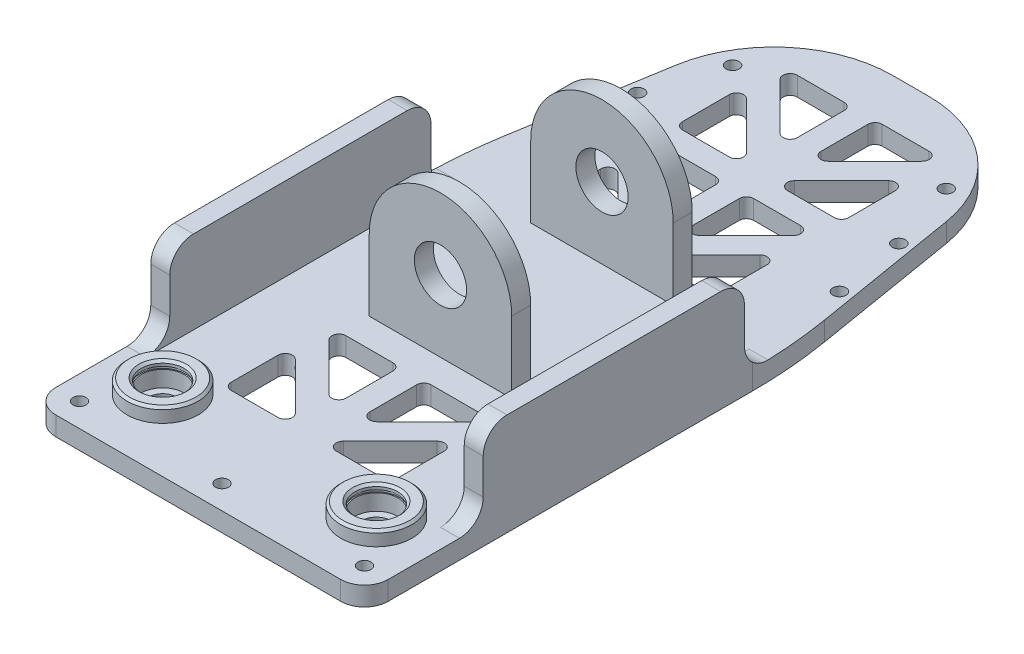
from build123d import *

# Parameters (mm, degrees)
EXTRUDE_1_DEPTH            = 8
EXTRUDE_START              = -100
EXTRUDE_3_DEPTH            = 80
SKETCH_5_W                 = 80
SKETCH_5_H                 = 60
CUT_EXTRUDE_2_DEPTH        = 110
FILLET_1_R                 = 50
FILLET_2_R                 = 200
SKETCH_7_R                 = 9
CUT_EXTRUDE_6_DEPTH        = 4
SKETCH_10_R                = 6
CUT_EXTRUDE_7_DEPTH        = 28
SKETCH_12_R                = 15
EXTRUDE_5_DEPTH            = 6
SKETCH_13_R                = 9
CUT_EXTRUDE_9_DEPTH        = 6
CUT_EXTRUDE_START          = -2.15
SKETCH_14_R                = 9.5
CUT_EXTRUDE_4235_DEPTH     = 1.1
CHAMFER_1_SIZE             = 1
CHAMFER_1_OF_MIRROR_1_SIZE = 1
SKETCH_23_W                = 8
SKETCH_23_H                = 110
EXTRUDE_7_DEPTH            = 35
FILLET_5_R                 = 10
MOVE_FACE_1_BY             = 2
MOVE_FACE_1_2_BY           = 2
SKETCH_24_R                = 2.75
CUT_EXTRUDE_13_DEPTH       = 40
FILLET_6_R                 = 3


with BuildPart() as part:
    # 草图1 → 凸台-拉伸1 (new body)
    with BuildSketch(Plane(origin=(0, 0, 0), x_dir=(1, 0, 0), z_dir=(0, 1, 0))):
        Polygon((-70, 0), (70, 0), (70, 180), (50, 300), (-50, 300), (-70, 180), align=None)
    extrude(amount=EXTRUDE_1_DEPTH)

    # 草图4 → 凸台-拉伸3 (add)
    with BuildSketch(Plane.XY.offset(EXTRUDE_START)):
        with BuildLine():
            Line((0, 27), (0, 8))
            Line((0, 8), (30, 8))
            Line((30, 8), (30, 38))
            ThreePointArc((30, 38), (21.213203436, 59.213203436), (0, 68))
            Line((0, 68), (0, 49))
            ThreePointArc((0, 49), (7.778174593, 45.778174593), (11, 38))
            ThreePointArc((11, 38), (7.778174593, 30.221825407), (0, 27))
        make_face()
        with BuildLine():
            Line((-30, 8), (0, 8))
            Line((0, 8), (0, 27))
            ThreePointArc((0, 27), (-11, 38), (0, 49))
            Line((0, 49), (0, 68))
            ThreePointArc((0, 68), (-21.213203436, 59.213203436), (-30, 38))
            Line((-30, 38), (-30, 8))
        make_face()
    extrude(amount=-EXTRUDE_3_DEPTH)

    # 草图5 → 切除-拉伸2 (cut)
    with BuildSketch(Plane(origin=(0, 8, 0), x_dir=(1, 0, 0), z_dir=(0, 1, 0))):
        with Locations((0, 140)):
            Rectangle(SKETCH_5_W, SKETCH_5_H)
    extrude(amount=CUT_EXTRUDE_2_DEPTH, mode=Mode.SUBTRACT)

    # 圆角1
    fillet_1_edges = [part.edges().sort_by_distance(p)[0] for p in [
        (-50, 4, -300),
        (50, 4, -300),
    ]]
    fillet(fillet_1_edges, radius=FILLET_1_R)

    # 圆角2
    fillet_2_edges = [part.edges().sort_by_distance(p)[0] for p in [
        (-70, 4, -180),
        (70, 4, -180),
    ]]
    fillet(fillet_2_edges, radius=FILLET_2_R)

    # 草图7 → 切除-拉伸6 (cut)
    with BuildSketch(Plane(origin=(0, 8, 0), x_dir=(1, 0, 0), z_dir=(0, 1, 0))):
        with Locations(Location((45, 30, 0), (0, 0, 270))):
            Circle(SKETCH_7_R)
    cut_extrude_6 = extrude(amount=-CUT_EXTRUDE_6_DEPTH, mode=Mode.SUBTRACT)

    # 草图10 → 切除-拉伸7 (cut)
    with BuildSketch(Plane(origin=(0, 4, 0), x_dir=(1, 0, 0), z_dir=(0, 1, 0))):
        with Locations(Location((45, 30, 0), (0, 0, 270))):
            Circle(SKETCH_10_R)
    cut_extrude_7 = extrude(amount=-CUT_EXTRUDE_7_DEPTH, mode=Mode.SUBTRACT)

    # 草图12 → 凸台-拉伸5 (add)
    with BuildSketch(Plane(origin=(0, 8, 0), x_dir=(1, 0, 0), z_dir=(0, 1, 0))):
        with Locations(Location((45, 30, 0), (0, 0, 270))):
            Circle(SKETCH_12_R)
    extrude_5 = extrude(amount=EXTRUDE_5_DEPTH)

    # 草图13 → 切除-拉伸9 (cut)
    with BuildSketch(Plane(origin=(0, 14, 0), x_dir=(1, 0, 0), z_dir=(0, 1, 0))):
        with Locations(Location((45, 30, 0), (0, 0, 270))):
            Circle(SKETCH_13_R)
    cut_extrude_9 = extrude(amount=-CUT_EXTRUDE_9_DEPTH, mode=Mode.SUBTRACT)

    # 草图14 → Cut-Extrude 4235 (cut)
    with BuildSketch(Plane(origin=(0, 14, 0), x_dir=(1, 0, 0), z_dir=(0, 1, 0)).offset(CUT_EXTRUDE_START)):
        with Locations(Location((45, 30, 0), (0, 0, 270))):
            Circle(SKETCH_14_R)
    cut_extrude_4235 = extrude(amount=-CUT_EXTRUDE_4235_DEPTH, mode=Mode.SUBTRACT)

    # 倒角1
    chamfer_1_edges = [part.edges().sort_by_distance(p)[0] for p in [
        (45, 14, -45),
        (45, 14, -39),
    ]]
    chamfer(chamfer_1_edges, length=CHAMFER_1_SIZE)

    # 镜向1: 切除-拉伸6, 切除-拉伸7, 凸台-拉伸5, 切除-拉伸9, Cut-Extrude 4235 across plane
    add(cut_extrude_6.mirror(Plane.ZY), mode=Mode.SUBTRACT)
    add(cut_extrude_7.mirror(Plane.ZY), mode=Mode.SUBTRACT)
    add(extrude_5.mirror(Plane.ZY))
    add(cut_extrude_9.mirror(Plane.ZY), mode=Mode.SUBTRACT)
    add(cut_extrude_4235.mirror(Plane.ZY), mode=Mode.SUBTRACT)

    # 倒角1 of 镜向1
    chamfer_1_of_mirror_1_edges = [part.edges().sort_by_distance(p)[0] for p in [
        (-45, 14, -45),
        (-45, 14, -39),
    ]]
    chamfer(chamfer_1_of_mirror_1_edges, length=CHAMFER_1_OF_MIRROR_1_SIZE)

    # 草图23 → 凸台-拉伸7 (add)
    with BuildSketch(Plane(origin=(0, 8, 0), x_dir=(1, 0, 0), z_dir=(0, 1, 0))):
        with Locations((66, 105)):
            Rectangle(SKETCH_23_W, SKETCH_23_H)
        with Locations((-66, 105)):
            Rectangle(SKETCH_23_W, SKETCH_23_H)
    extrude(amount=EXTRUDE_7_DEPTH)

    # 圆角5
    fillet_5_edges = [part.edges().sort_by_distance(p)[0] for p in [
        (70, 4, 0),
        (-70, 4, 0),
        (66, 8, -50),
        (66, 8, -160),
        (66, 43, -50),
        (66, 43, -160),
        (-66, 8, -160),
        (-66, 8, -50),
        (-66, 43, -160),
        (-66, 43, -50),
    ]]
    fillet(fillet_5_edges, radius=FILLET_5_R)

    # Move Face 1: a face moved inward by 2.0
    extrude(part.faces().sort_by_distance((0, 23, -180))[0], amount=MOVE_FACE_1_BY, dir=(0, 0, 1), mode=Mode.SUBTRACT)

    # Move Face 1 2: a face moved inward by 2.0
    extrude(part.faces().sort_by_distance((0, 23, -100))[0], amount=MOVE_FACE_1_2_BY, dir=(0, 0, -1), mode=Mode.SUBTRACT)

    # 草图24 → 切除-拉伸13 (cut)
    with BuildSketch(Plane(origin=(0, 8, 0), x_dir=(1, 0, 0), z_dir=(0, 1, 0))):
        with Locations(Location((45, 270, 0), (0, 0, 270))):
            Circle(SKETCH_24_R)
        with Locations(Location((55, 240, 0), (0, 0, 270))):
            Circle(SKETCH_24_R)
        with Locations(Location((60, 210, 0), (0, 0, 270))):
            Circle(SKETCH_24_R)
        with Locations(Location((60, 10, 0), (0, 0, 270))):
            Circle(SKETCH_24_R)
        with Locations(Location((0, 10, 0), (0, 0, 270))):
            Circle(SKETCH_24_R)
        with Locations(Location((-60, 10, 0), (0, 0, 270))):
            Circle(SKETCH_24_R)
        with Locations(Location((-60, 210, 0), (0, 0, 270))):
            Circle(SKETCH_24_R)
        with Locations(Location((-55, 240, 0), (0, 0, 270))):
            Circle(SKETCH_24_R)
        with Locations(Location((-45, 270, 0), (0, 0, 270))):
            Circle(SKETCH_24_R)
        Polygon((5, 90), (35, 90), (5, 60), align=None)
        Polygon((35, 75.857864376), (5, 45.857864376), (35, 45.857864376), align=None)
        Polygon((-5, 45.857864376), (-35, 45.857864376), (-35, 75.857864376), align=None)
        Polygon((-35, 90), (-5, 60), (-5, 90), align=None)
        Polygon((5, 280), (35, 280), (5, 250), align=None)
        Polygon((35, 265.857864376), (5, 235.857864376), (35, 235.857864376), align=None)
        Polygon((5, 225.857864376), (35, 225.857864376), (5, 195.857864376), align=None)
        Polygon((35, 211.715728753), (5, 181.715728753), (35, 181.715728753), align=None)
        Polygon((-35, 181.715728753), (-35, 211.715728753), (-5, 181.715728753), align=None)
        Polygon((-5, 195.857864376), (-5, 225.857864376), (-35, 225.857864376), align=None)
        Polygon((-35, 235.857864376), (-35, 265.857864376), (-5, 235.857864376), align=None)
        Polygon((-5, 250), (-5, 280), (-35, 280), align=None)
    extrude(amount=-CUT_EXTRUDE_13_DEPTH, mode=Mode.SUBTRACT)

    # 圆角6
    fillet_6_edges = [part.edges().sort_by_distance(p)[0] for p in [
        (-35, 4, -90),
        (-5, 4, -90),
        (-5, 4, -60),
        (5, 4, -250),
        (5, 4, -280),
        (35, 4, -280),
        (35, 4, -265.857864376),
        (35, 4, -235.857864376),
        (5, 4, -235.857864376),
        (35, 4, -75.857864376),
        (35, 4, -45.857864376),
        (5, 4, -45.857864376),
        (-35, 4, -75.857864376),
        (-5, 4, -45.857864376),
        (-35, 4, -45.857864376),
        (-5, 4, -235.857864376),
        (-35, 4, -235.857864376),
        (-35, 4, -265.857864376),
        (-5, 4, -250),
        (-35, 4, -280),
        (-5, 4, -280),
        (-5, 4, -181.715728753),
        (-35, 4, -181.715728753),
        (-35, 4, -211.715728753),
        (5, 4, -195.857864376),
        (5, 4, -225.857864376),
        (35, 4, -225.857864376),
        (35, 4, -211.715728753),
        (35, 4, -181.715728753),
        (5, 4, -181.715728753),
        (-5, 4, -195.857864376),
        (-35, 4, -225.857864376),
        (-5, 4, -225.857864376),
        (5, 4, -60),
        (5, 4, -90),
        (35, 4, -90),
    ]]
    fillet(fillet_6_edges, radius=FILLET_6_R)


solid = part.part
